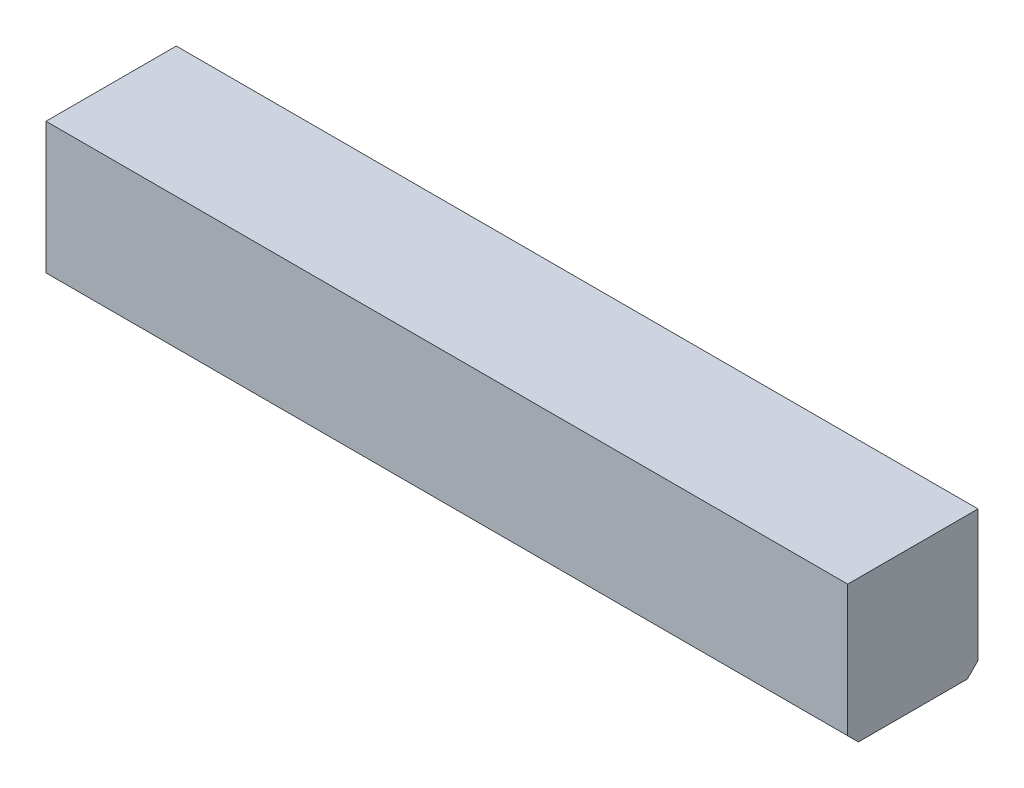
from build123d import *

# Parameters (mm, degrees)
SPACER_DEPTH = 30


with BuildPart() as part:
    # spacer sketch → spacer (new, symmetric)
    with BuildSketch(Plane(origin=(30, 0, 0), x_dir=(0, 0, -1), z_dir=(1, 0, 0))):
        Polygon((-0.8, 0), (0, 0.8), (0, 10.63), (-9.75, 10.63), (-9.75, 0.8), (-8.95, 0), align=None)
    extrude(amount=SPACER_DEPTH, both=True)


solid = part.part
